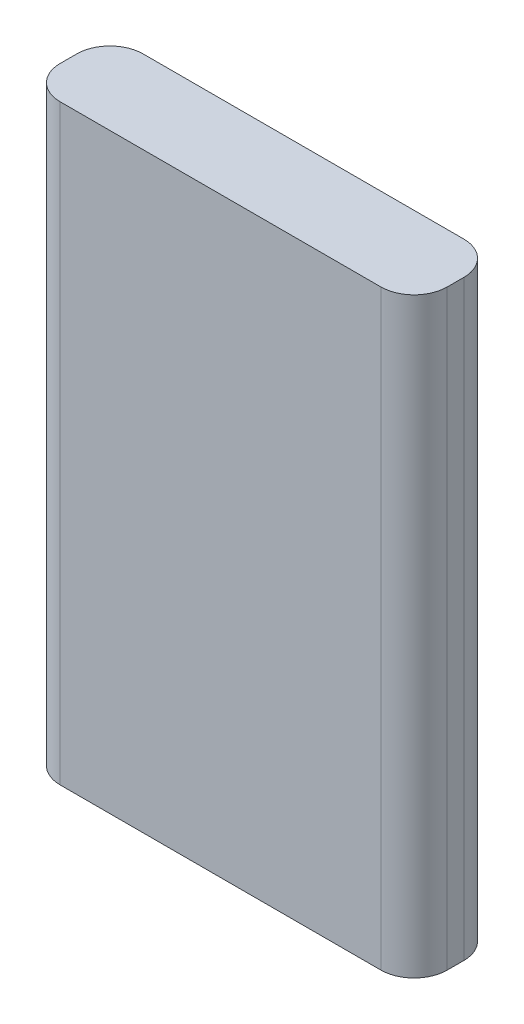
from build123d import *

# Parameters (mm, degrees)
CROQUIS1_W              = 35
CROQUIS1_H              = 53.5
SALIENTE_EXTRUIR1_DEPTH = 7.5
REDONDEO1_R             = 3


with BuildPart() as part:
    # Croquis1 → Saliente-Extruir1 (new body)
    with BuildSketch(Plane.XY):
        Rectangle(CROQUIS1_W, CROQUIS1_H)
    extrude(amount=SALIENTE_EXTRUIR1_DEPTH)

    # Redondeo1
    redondeo1_edges = [part.edges().sort_by_distance(p)[0] for p in [
        (17.5, 0, 7.5),
        (-17.5, 0, 7.5),
        (17.5, 0, 0),
        (-17.5, 0, 0),
    ]]
    fillet(redondeo1_edges, radius=REDONDEO1_R)


solid = part.part
